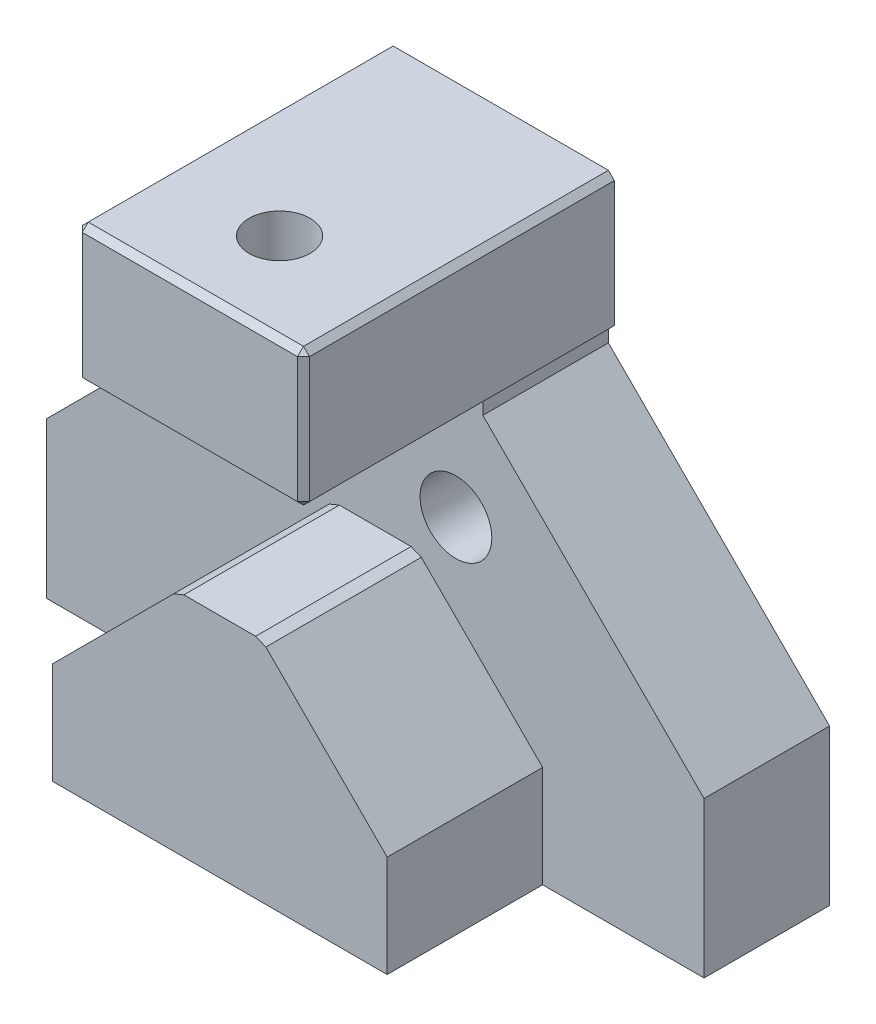
from build123d import *

# Parameters (mm, degrees)
BOSS_EXTRUDE1_DEPTH        = 21
SKETCH2_W                  = 38
SKETCH2_H                  = 23
BOSS_EXTRUDE2_DEPTH        = 52
BOSS_EXTRUDE3_DEPTH        = 26
CHAMFER1_SIZE              = 1
M12_TAPPED_HOLE1_D         = 10.2
M12_TAPPED_HOLE1_DEPTH     = 23
F_12_0_12_DIAMETER_HOLE1_D = 12
CHAMFER2_SIZE              = 1


with BuildPart() as part:
    # Sketch1 → Boss-Extrude1 (new body)
    with BuildSketch(Plane.XY):
        Polygon((-19, 0), (19, 0), (19, -23), (18, -23), (18, -25), (55, -62), (55, -88), (-55, -88), (-55, -62), (-18, -25), (-18, -23), (-19, -23), align=None)
    extrude(amount=BOSS_EXTRUDE1_DEPTH)

    # Sketch2 → Boss-Extrude2 (add)
    with BuildSketch(Plane(origin=(0, 0, 0), x_dir=(-1, 0, 0), z_dir=(0, 0, -1))):
        with Locations((0, -11.5)):
            Rectangle(SKETCH2_W, SKETCH2_H)
    extrude(amount=-BOSS_EXTRUDE2_DEPTH)

    # Sketch3 → Boss-Extrude3 (add)
    with BuildSketch(Plane.XY.offset(21)):
        Polygon((-7, -50), (7, -50), (28, -71), (28, -88), (-28, -88), (-28, -71), align=None)
    extrude(amount=BOSS_EXTRUDE3_DEPTH)

    # Chamfer1
    chamfer1_edges = [part.edges().sort_by_distance(p)[0] for p in [
        (0, -23, 52),
        (-19, -23, 26),
        (-19, -11.5, 52),
        (19, -23, 26),
        (19, -11.5, 52),
        (19, 0, 26),
        (0, 0, 52),
        (-19, 0, 26),
    ]]
    chamfer(chamfer1_edges, length=CHAMFER1_SIZE)

    # M12 Tapped Hole1
    with Locations(Plane(origin=(0, 0, 0), x_dir=(1, 0, 0), z_dir=(0, 1, 0))):
        with Locations((0, -37)):
            Hole(M12_TAPPED_HOLE1_D / 2, depth=M12_TAPPED_HOLE1_DEPTH)

    # Ø12.0 (12) Diameter Hole1 (through all)
    with Locations(Plane.XY.offset(21)):
        with Locations((-13.5, -42), (13.5, -42)):
            Hole(F_12_0_12_DIAMETER_HOLE1_D / 2)

    # Chamfer2
    chamfer2_edges = [part.edges().sort_by_distance(p)[0] for p in [
        (7, -50, 34),
        (-7, -50, 34),
    ]]
    chamfer(chamfer2_edges, length=CHAMFER2_SIZE)


solid = part.part
